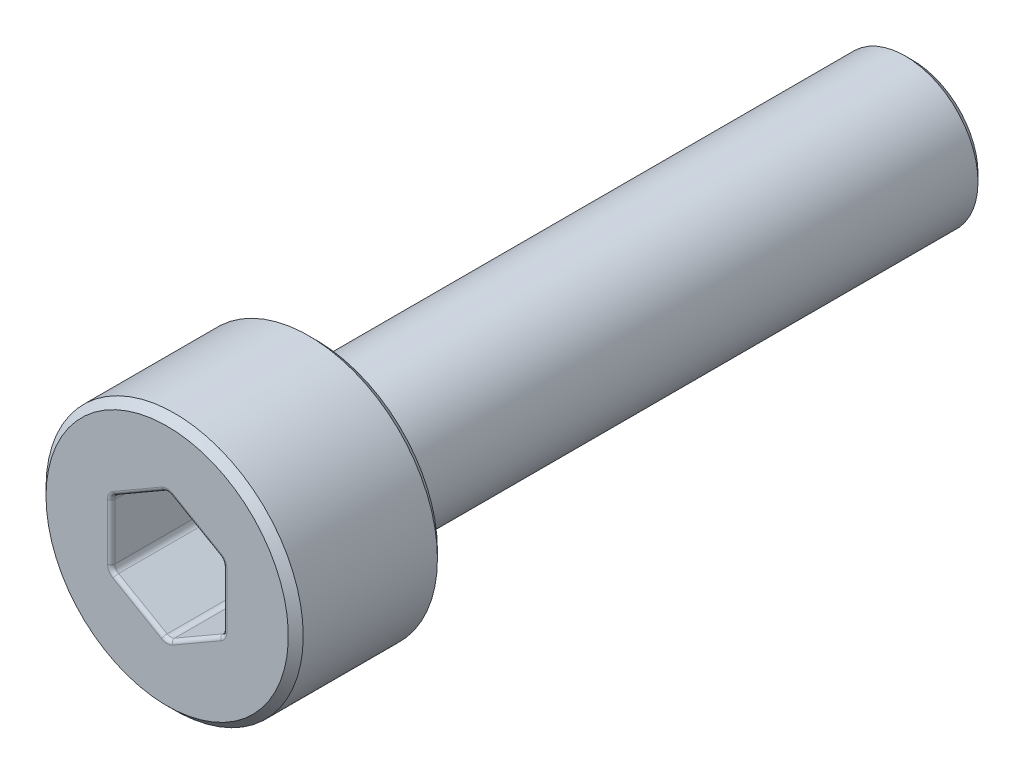
from build123d import *

# Parameters (mm, degrees)
SCHNITT_LINEAR_AUSTRAGEN1_DEPTH = 2.5
FASE1_SIZE                      = 0.2
VERRUNDUNG1_R                   = 0.2
VERRUNDUNG2_R                   = 0.1


with BuildPart() as part:
    # Skizze1 → Rotation1 (revolve)
    with BuildSketch(Plane(origin=(0, 0, 0), x_dir=(0, 0, -1), z_dir=(1, 0, 0))):
        Polygon((-4, 0), (-4, 3.45), (0, 3.45), (0, 1.95), (16, 1.95), (16, 0), align=None)
    revolve(axis=Axis((0, 0, 21.919879518), (0, 0, -1)))

    # Skizze2 → Schnitt-Linear austragen1 (cut)
    with BuildSketch(Plane.XY.offset(4)):
        Polygon((1.5, -0.866025404), (1.5, 0.866025404), (0, 1.732050808), (-1.5, 0.866025404), (-1.5, -0.866025404), (0, -1.732050808), align=None)
    extrude(amount=-SCHNITT_LINEAR_AUSTRAGEN1_DEPTH, mode=Mode.SUBTRACT)

    # Fase1
    fase1_edges = [part.edges().sort_by_distance(p)[0] for p in [
        (0, -3.45, 4),
        (0, -3.45, 0),
        (0, -1.95, -16),
    ]]
    chamfer(fase1_edges, length=FASE1_SIZE)

    # Verrundung1
    verrundung1_edges = [part.edges().sort_by_distance(p)[0] for p in [
        (-0.75, -1.299038106, 1.5),
        (-1.5, 0, 1.5),
        (-0.75, 1.299038106, 1.5),
        (0.75, 1.299038106, 1.5),
        (1.5, 0, 1.5),
        (0.75, -1.299038106, 1.5),
        (-1.5, -0.866025404, 2.75),
        (0, -1.732050808, 2.75),
        (1.5, -0.866025404, 2.75),
        (1.5, 0.866025404, 2.75),
        (0, 1.732050808, 2.75),
        (-1.5, 0.866025404, 2.75),
        (0, -1.95, 0),
    ]]
    fillet(verrundung1_edges, radius=VERRUNDUNG1_R)

    # Verrundung2
    verrundung2_edges = [part.edges().sort_by_distance(p)[0] for p in [
        (1.473205081, -0.85055535, 4),
        (0.75, -1.299038106, 4),
        (0, -1.7011107, 4),
        (-0.75, -1.299038106, 4),
        (-1.473205081, -0.85055535, 4),
        (-1.5, 0, 4),
        (-1.473205081, 0.85055535, 4),
        (-0.75, 1.299038106, 4),
        (0, 1.7011107, 4),
        (0.75, 1.299038106, 4),
        (1.473205081, 0.85055535, 4),
        (1.5, 0, 4),
    ]]
    fillet(verrundung2_edges, radius=VERRUNDUNG2_R)


solid = part.part
